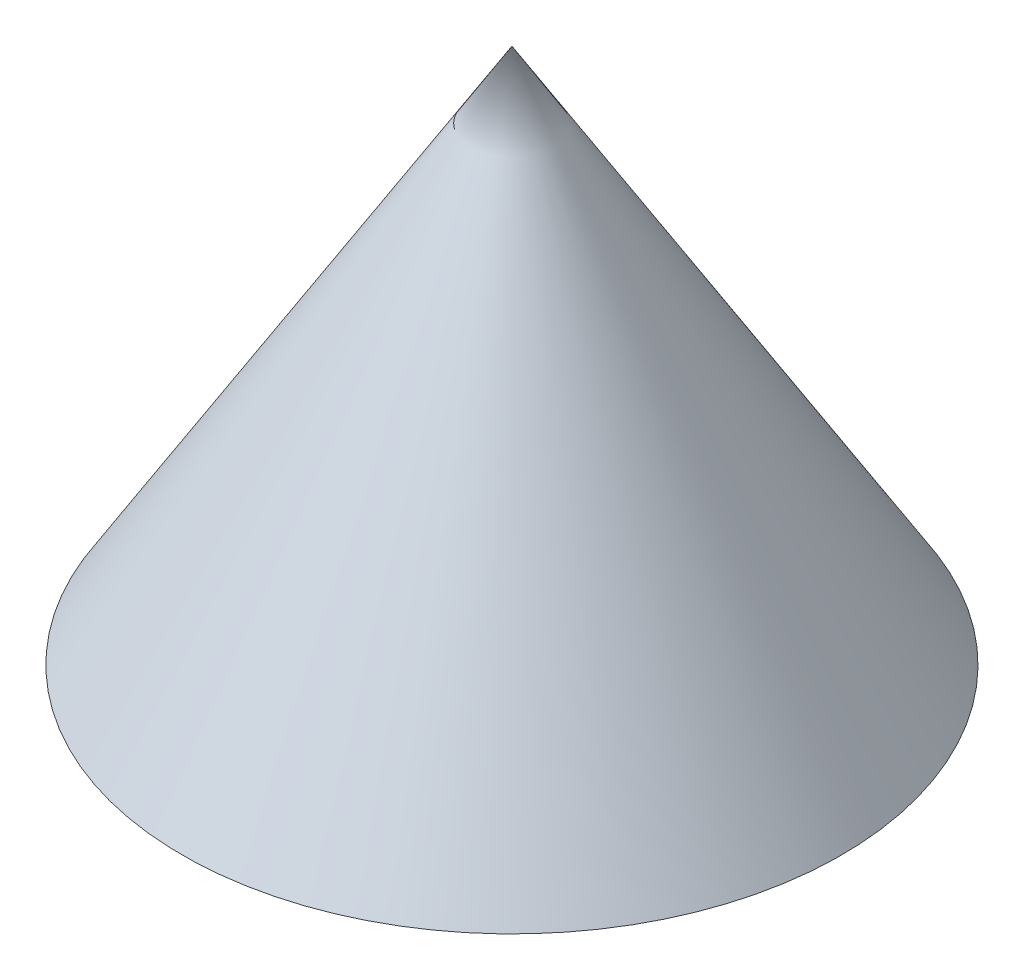
from build123d import *


with BuildPart() as part:
    # Sketch1 → Revolve1 (revolve)
    with BuildSketch(Plane.XY, mode=Mode.PRIVATE) as revolve1_sk:
        Polygon((0, 0), (0, 43.563704058), (26.795787779, 0), align=None)
    revolve(revolve1_sk.sketch.rotate(Axis((0, 0, 0), (0, 1, 0)), 90), axis=Axis((0, 0, 0), (0, 1, 0)))


solid = part.part
